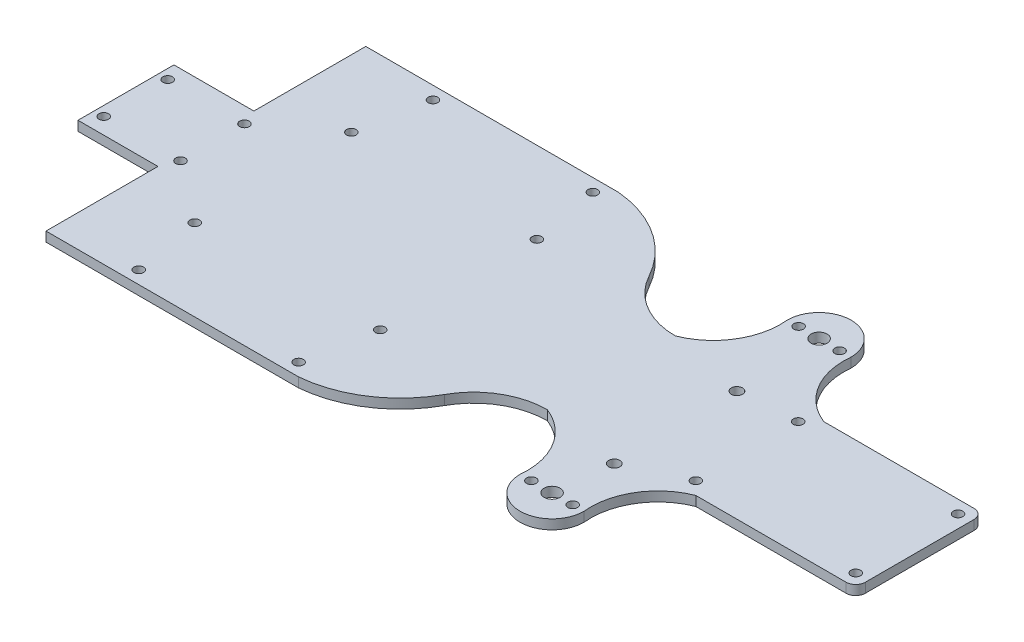
from build123d import *

# Parameters (mm, degrees)
CROQUIS1_R              = 1.5
CROQUIS1_R_2            = 2.5
SALIENTE_EXTRUIR1_DEPTH = 3
CROQUIS2_R              = 1.5
CORTAR_EXTRUIR1_DEPTH   = 10
CROQUIS4_R              = 1.5
CORTAR_EXTRUIR2_DEPTH   = 10
CROQUIS6_R              = 1.75
CORTAR_EXTRUIR4_DEPTH   = 181.797465623
CROQUIS7_R              = 1.5
CORTAR_EXTRUIR5_DEPTH   = 10


with BuildPart() as part:
    # Croquis1 → Saliente-Extruir1 (new body)
    with BuildSketch(Plane(origin=(0, 0, 0), x_dir=(1, 0, 0), z_dir=(0, 1, 0))):
        with BuildLine():
            Line((-50, -50), (29, -50))
            ThreePointArc((29, -50), (45.026638216, -44.431709815), (56.55148357, -31.980327255))
            ThreePointArc((56.55148357, -31.980327255), (65.032402177, -23.219540774), (76.793010893, -20))
            ThreePointArc((76.793010893, -20), (87.064733458, -28.647586327), (90, -41.75))
            ThreePointArc((90, -41.75), (100, -51.75), (110, -41.75))
            ThreePointArc((110, -41.75), (112.935266542, -28.647586327), (123.206989107, -20))
            Line((123.206989107, -20), (170.206989107, -20))
            ThreePointArc((170.206989107, -20), (172.328309451, -19.121320344), (173.206989107, -17))
            Line((173.206989107, -17), (173.206989107, 17))
            ThreePointArc((173.206989107, 17), (172.328309451, 19.121320344), (170.206989107, 20))
            Line((170.206989107, 20), (123.206989107, 20))
            ThreePointArc((123.206989107, 20), (112.935266542, 28.647586327), (110, 41.75))
            ThreePointArc((110, 41.75), (100, 51.75), (90, 41.75))
            ThreePointArc((90, 41.75), (87.064733458, 28.647586327), (76.793010893, 20))
            ThreePointArc((76.793010893, 20), (65.032402177, 23.219540774), (56.55148357, 31.980327255))
            ThreePointArc((56.55148357, 31.980327255), (45.026638216, 44.431709815), (29, 50))
            Line((29, 50), (-50, 50))
            Line((-50, 50), (-50, 15))
            Line((-50, 15), (-75, 15))
            Line((-75, 15), (-75, -15))
            Line((-75, -15), (-50, -15))
            Line((-50, -15), (-50, -50))
        make_face()
        with Locations(Location((-29, -24.5, 0), (0, 0, 270))):
            Circle(CROQUIS1_R, mode=Mode.SUBTRACT)
        with Locations(Location((29, -24.5, 0), (0, 0, 270))):
            Circle(CROQUIS1_R, mode=Mode.SUBTRACT)
        with Locations(Location((100, -41.75, 0), (0, 0, 270))):
            Circle(CROQUIS1_R_2, mode=Mode.SUBTRACT)
        with Locations(Location((-29, 24.5, 0), (0, 0, 270))):
            Circle(CROQUIS1_R, mode=Mode.SUBTRACT)
        with Locations(Location((29, 24.5, 0), (0, 0, 270))):
            Circle(CROQUIS1_R, mode=Mode.SUBTRACT)
        with Locations(Location((100, 41.75, 0), (0, 0, 270))):
            Circle(CROQUIS1_R_2, mode=Mode.SUBTRACT)
    extrude(amount=SALIENTE_EXTRUIR1_DEPTH)

    # Croquis2 → Cortar-Extruir1 (cut)
    with BuildSketch(Plane.XZ):
        with Locations(Location((-72, 9.943892899, 0), (0, 0, 270))):
            Circle(CROQUIS2_R)
        with Locations(Location((-48, 9.943892899, 0), (0, 0, 270))):
            Circle(CROQUIS2_R)
        with Locations(Location((-72, -10.056107101, 0), (0, 0, 270))):
            Circle(CROQUIS2_R)
        with Locations(Location((-48, -10.056107101, 0), (0, 0, 270))):
            Circle(CROQUIS2_R)
    extrude(amount=-CORTAR_EXTRUIR1_DEPTH, mode=Mode.SUBTRACT)

    # Croquis4 → Cortar-Extruir2 (cut)
    with BuildSketch(Plane.XZ):
        with Locations(Location((-25, 46, 0), (0, 0, 270))):
            Circle(CROQUIS4_R)
        with Locations(Location((25, 46, 0), (0, 0, 270))):
            Circle(CROQUIS4_R)
        with Locations(Location((119.206989107, 16, 0), (0, 0, 270))):
            Circle(CROQUIS4_R)
        with Locations(Location((169.206989107, 16, 0), (0, 0, 270))):
            Circle(CROQUIS4_R)
        with Locations(Location((169.206989107, -16, 0), (0, 0, 90))):
            Circle(CROQUIS4_R)
        with Locations(Location((119.206989107, -16, 0), (0, 0, 90))):
            Circle(CROQUIS4_R)
        with Locations(Location((25, -46, 0), (0, 0, 90))):
            Circle(CROQUIS4_R)
        with Locations(Location((-25, -46, 0), (0, 0, 90))):
            Circle(CROQUIS4_R)
    extrude(amount=-CORTAR_EXTRUIR2_DEPTH, mode=Mode.SUBTRACT)

    # Croquis6 → Cortar-Extruir4 (cut, through all)
    with BuildSketch(Plane(origin=(0, 3, 0), x_dir=(1, 0, 0), z_dir=(0, 1, 0))):
        with Locations(Location((101.826339239, -24.115973685, 0), (0, 0, 270))):
            Circle(CROQUIS6_R)
        with Locations(Location((101.373426984, 14.680198998, 0), (0, 0, 270))):
            Circle(CROQUIS6_R)
    extrude(amount=-CORTAR_EXTRUIR4_DEPTH, mode=Mode.SUBTRACT)

    # Croquis7 → Cortar-Extruir5 (cut)
    with BuildSketch(Plane.XZ):
        with Locations(Location((93.500729234, -41.847362769, 0), (0, 0, 270))):
            Circle(CROQUIS7_R)
        with Locations(Location((106.499270766, -41.652637231, 0), (0, 0, 270))):
            Circle(CROQUIS7_R)
        with Locations(Location((93.500127651, 41.709263638, 0), (0, 0, 270))):
            Circle(CROQUIS7_R)
        with Locations(Location((106.499872349, 41.790736362, 0), (0, 0, 270))):
            Circle(CROQUIS7_R)
    extrude(amount=-CORTAR_EXTRUIR5_DEPTH, mode=Mode.SUBTRACT)


solid = part.part
